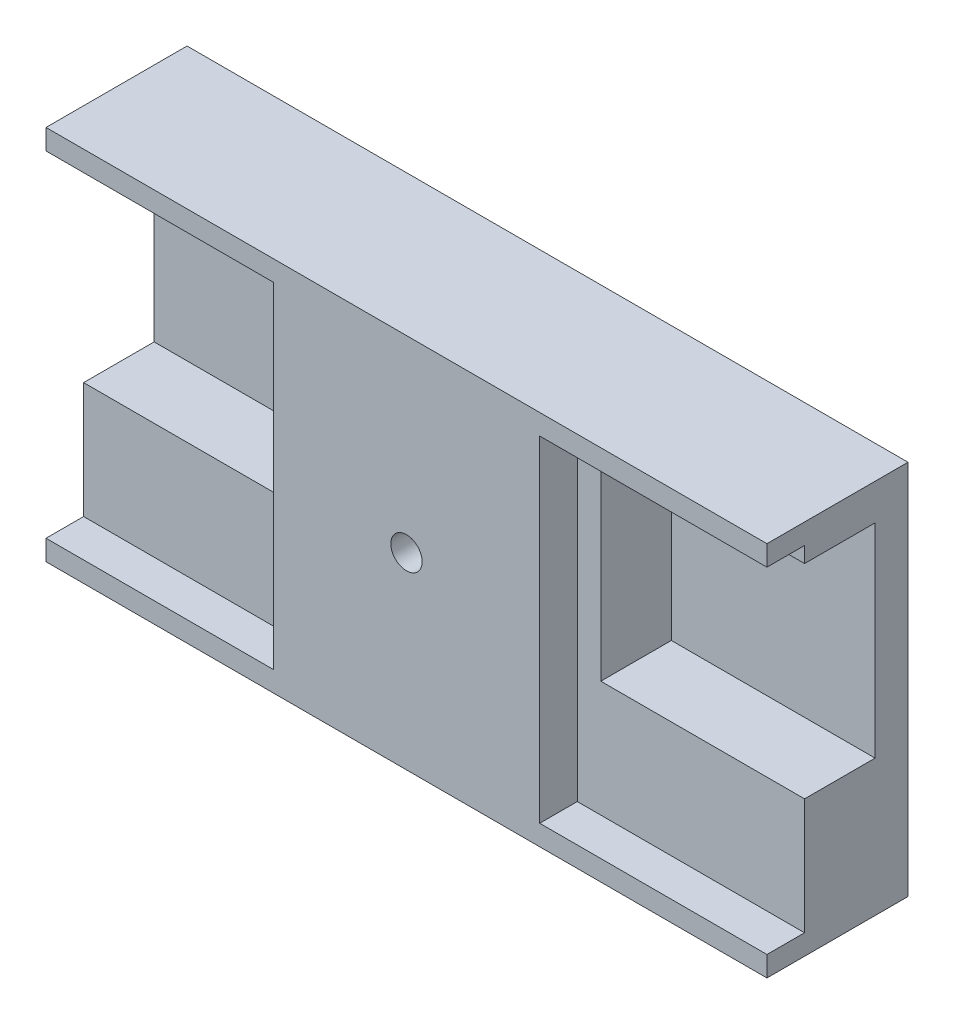
from build123d import *

# Parameters (mm, degrees)
ESQUISSE1_W             = 46
ESQUISSE1_H             = 24
BOSS_EXTRU_1_DEPTH      = 9
ESQUISSE2_R             = 1
ENL_V_MAT_EXTRU_1_DEPTH = 19
ESQUISSE3_W             = 15.6
ESQUISSE3_H             = 21.4
ENL_V_MAT_EXTRU_2_DEPTH = 2.4
ESQUISSE4_W             = 14
ESQUISSE4_H             = 13
ENL_V_MAT_EXTRU_3_DEPTH = 4.5


with BuildPart() as part:
    # Esquisse1 → Boss.-Extru.1 (new body)
    with BuildSketch(Plane.XY):
        with Locations((-0.106918239, 8.880503145)):
            Rectangle(ESQUISSE1_W, ESQUISSE1_H)
    extrude(amount=BOSS_EXTRU_1_DEPTH)

    # Esquisse2 → Enlèv. mat.-Extru.1 (cut)
    with BuildSketch(Plane.XY.offset(9)):
        with Locations((-0.106918239, 8.880503145)):
            Circle(ESQUISSE2_R)
    extrude(amount=-ENL_V_MAT_EXTRU_1_DEPTH, mode=Mode.SUBTRACT)

    # Esquisse3 → Enlèv. mat.-Extru.2 (cut)
    with BuildSketch(Plane.XY.offset(9)):
        with Locations((-16.406918239, 8.880503145)):
            Rectangle(ESQUISSE3_W, ESQUISSE3_H)
        with Locations((16.193081761, 8.880503145)):
            Rectangle(ESQUISSE3_W, ESQUISSE3_H)
    extrude(amount=-ENL_V_MAT_EXTRU_2_DEPTH, mode=Mode.SUBTRACT)

    # Esquisse4 → Enlèv. mat.-Extru.3 (cut)
    with BuildSketch(Plane.XY.offset(6.6)):
        with Locations((-17.106918239, 12.080503145)):
            Rectangle(ESQUISSE4_W, ESQUISSE4_H)
        with Locations((16.893081761, 12.080503145)):
            Rectangle(ESQUISSE4_W, ESQUISSE4_H)
    extrude(amount=-ENL_V_MAT_EXTRU_3_DEPTH, mode=Mode.SUBTRACT)


solid = part.part
